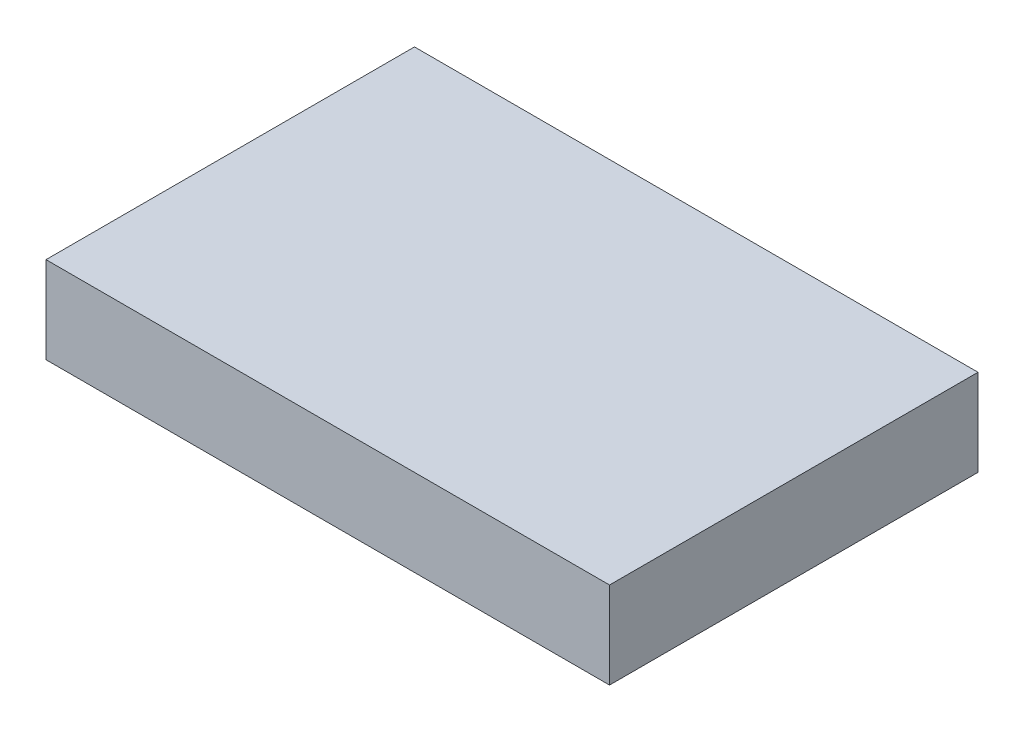
from build123d import *

# Parameters (mm, degrees)
SKETCH1_W           = 26
SKETCH1_H           = 17
BOSS_EXTRUDE1_DEPTH = 4


with BuildPart() as part:
    # Sketch1 → Boss-Extrude1 (new body)
    with BuildSketch(Plane(origin=(0, 0, 0), x_dir=(1, 0, 0), z_dir=(0, 1, 0))):
        Rectangle(SKETCH1_W, SKETCH1_H)
    extrude(amount=BOSS_EXTRUDE1_DEPTH)


solid = part.part
